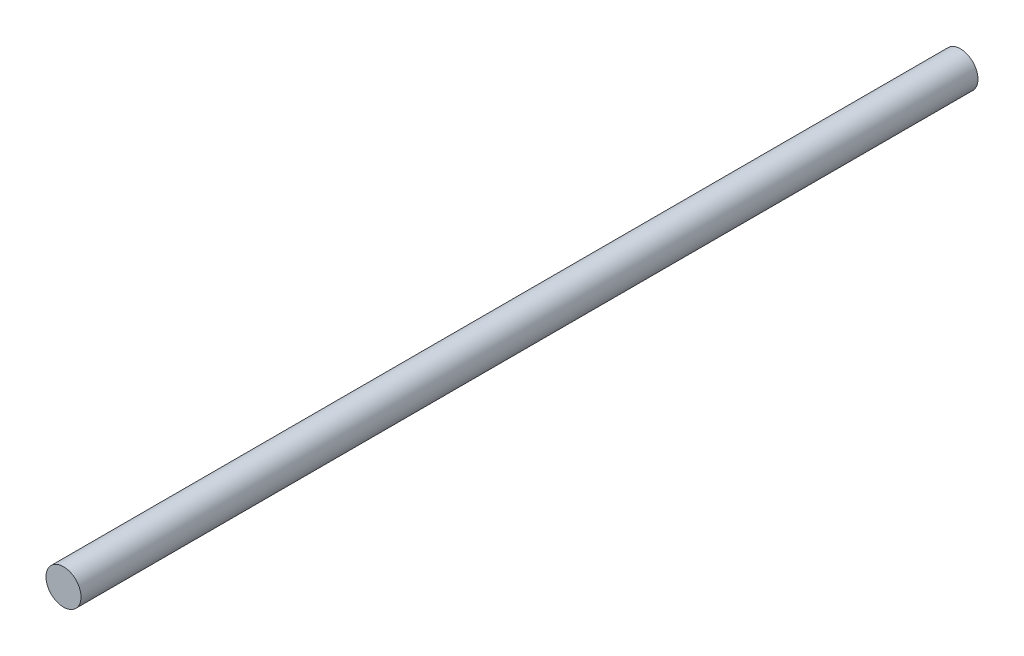
from build123d import *

# Parameters (mm, degrees)
SKETCH1_R           = 12.7
BOSS_EXTRUDE1_DEPTH = 650


with BuildPart() as part:
    # Sketch1 → Boss-Extrude1 (new body)
    with BuildSketch(Plane.XY):
        Circle(SKETCH1_R)
    extrude(amount=BOSS_EXTRUDE1_DEPTH)


solid = part.part
